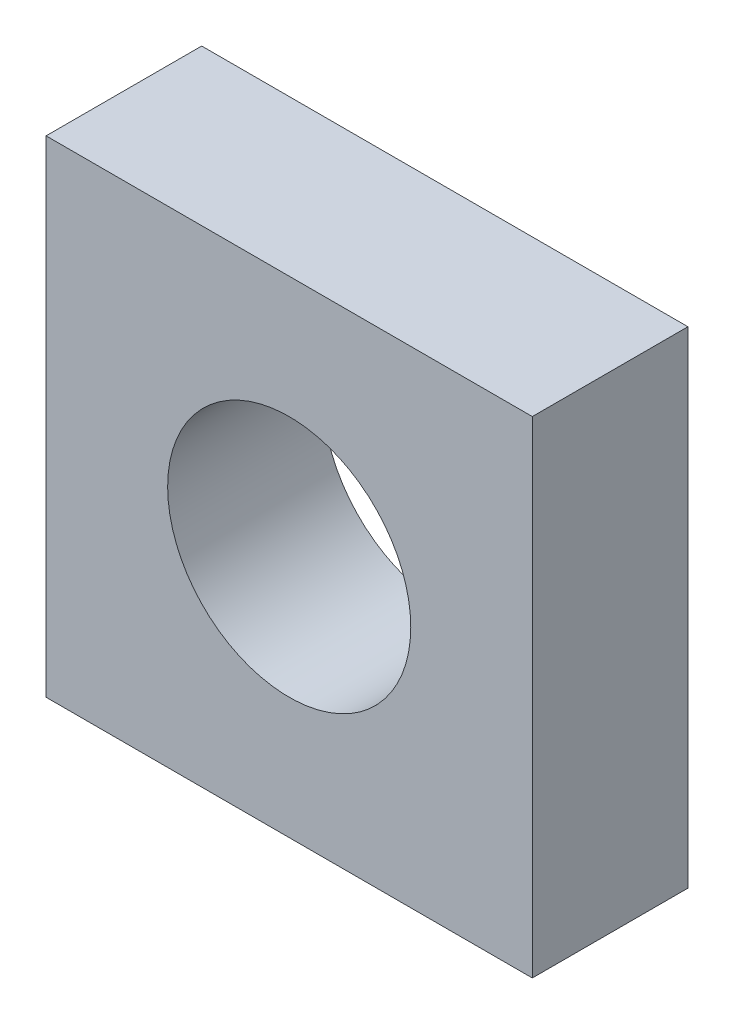
from build123d import *

# Parameters (mm, degrees)
SKETCH_1_W            = 5
SKETCH_1_H            = 5
DIN562_DEPTH          = 1.6
SKETCH_2_R            = 1.25
CUT_EXTRUDE_380_DEPTH = 1.6


with BuildPart() as part:
    # 草图1 → DIN562薄方螺母_外形 (new body)
    with BuildSketch(Plane.XY):
        Rectangle(SKETCH_1_W, SKETCH_1_H)
    extrude(amount=DIN562_DEPTH)

    # 草图2 → Cut-Extrude 380 (cut)
    with BuildSketch(Plane.XY):
        Circle(SKETCH_2_R)
    extrude(amount=CUT_EXTRUDE_380_DEPTH, mode=Mode.SUBTRACT)


solid = part.part
